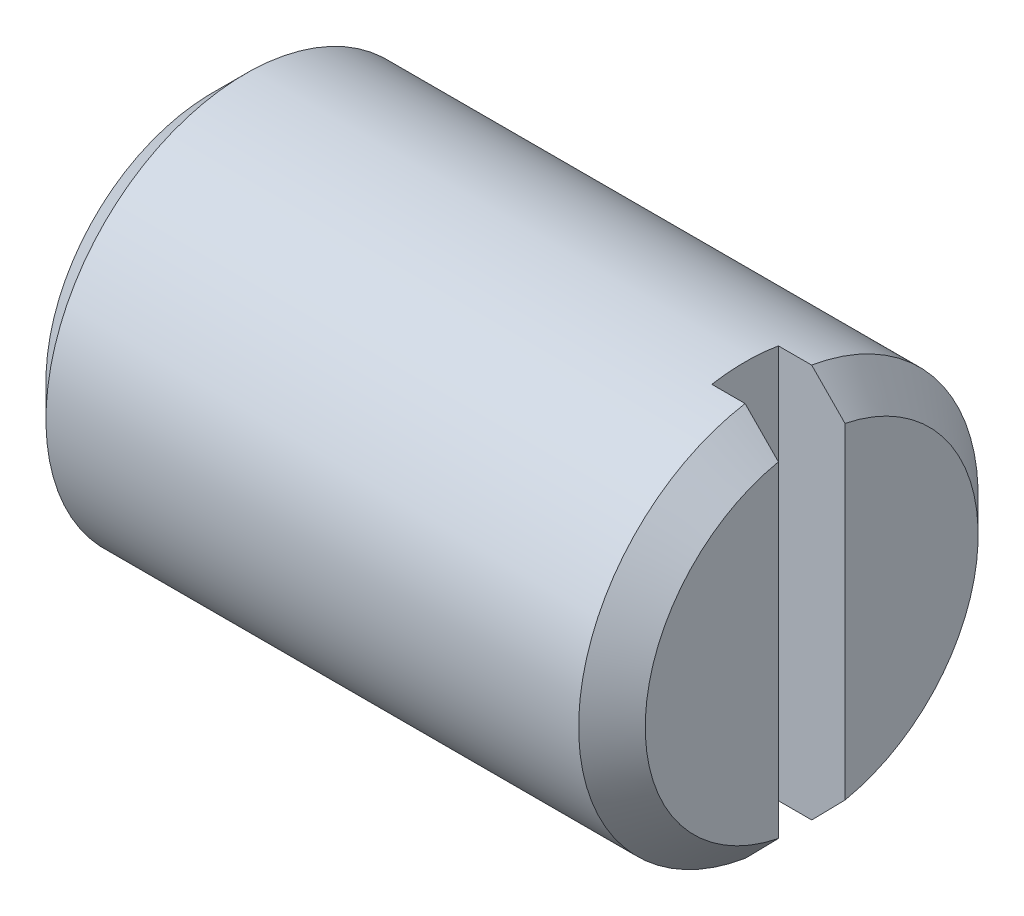
from build123d import *

# Parameters (mm, degrees)
CROQUIS1_R              = 3
SALIENTE_EXTRUIR1_DEPTH = 9
CROQUIS2_W              = 1
CROQUIS2_H              = 7
CORTAR_EXTRUIR1_DEPTH   = 1
CHAFL_N1_SIZE           = 0.5


with BuildPart() as part:
    # Croquis1 → Saliente-Extruir1 (new body)
    with BuildSketch(Plane(origin=(0, 0, 0), x_dir=(0, 0, -1), z_dir=(1, 0, 0))):
        Circle(CROQUIS1_R)
    extrude(amount=SALIENTE_EXTRUIR1_DEPTH)

    # Croquis2 → Cortar-Extruir1 (cut)
    with BuildSketch(Plane(origin=(9, 0, 0), x_dir=(0, 0, -1), z_dir=(1, 0, 0))):
        Rectangle(CROQUIS2_W, CROQUIS2_H)
    extrude(amount=-CORTAR_EXTRUIR1_DEPTH, mode=Mode.SUBTRACT)

    # Chaflán1
    chafl_n1_edges = [part.edges().sort_by_distance(p)[0] for p in [
        (0, 0, 3),
        (9, 0, 3),
        (9, -1.936491673, -2.291287847),
    ]]
    chamfer(chafl_n1_edges, length=CHAFL_N1_SIZE)


solid = part.part
